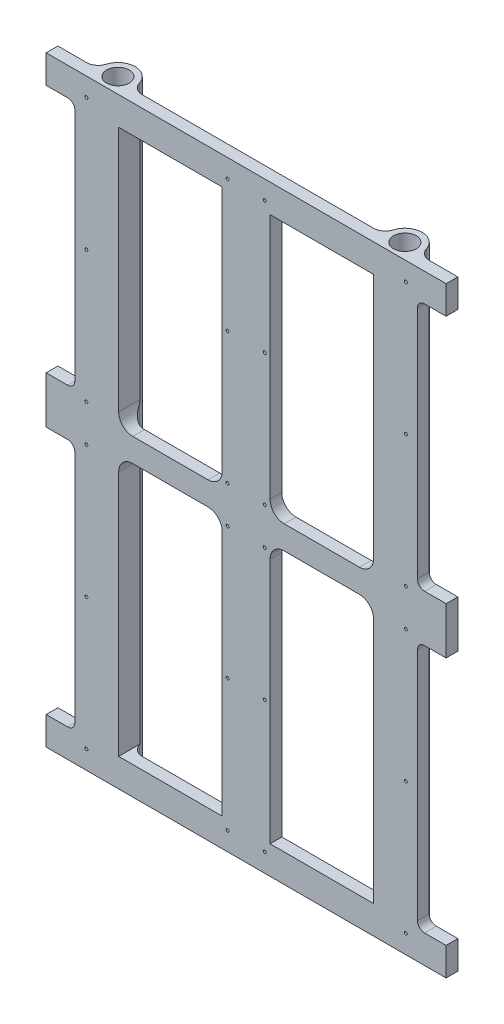
from build123d import *

# Parameters (mm, degrees)
SKETCH1_R                    = 4.825
BOSS_EXTRUDE1_DEPTH          = 255.6
CUT_EXTRUDE2_DEPTH           = 270.507403655
CUT_EXTRUDE2_DEPTH_BACK      = 270.507403655
F_1_25_1_25_DIAMETER_HOLE1_D = 1.25
SKETCH5_R                    = 1.5
CUT_EXTRUDE3_DEPTH           = 270.507403753


with BuildPart() as part:
    # Sketch1 → Boss-Extrude1 (new body)
    with BuildSketch(Plane(origin=(0, 0, 0), x_dir=(1, 0, 0), z_dir=(0, 1, 0))):
        with BuildLine():
            Line((85, -5), (85, 0))
            Line((85, 0), (72.817598106, 0))
            ThreePointArc((72.817598106, 0), (69.825892195, 0.993792849), (68.023440659, 3.580121704))
            ThreePointArc((68.023440659, 3.580121704), (61, 8.825), (53.976559341, 3.580121704))
            ThreePointArc((53.976559341, 3.580121704), (52.174107805, 0.993792849), (49.182401894, 0))
            Line((49.182401894, 0), (-49.182401894, 0))
            ThreePointArc((-49.182401894, 0), (-52.174107805, 0.993792849), (-53.976559341, 3.580121704))
            ThreePointArc((-53.976559341, 3.580121704), (-61, 8.825), (-68.023440659, 3.580121704))
            ThreePointArc((-68.023440659, 3.580121704), (-69.825892195, 0.993792849), (-72.817598106, 0))
            Line((-72.817598106, 0), (-85, 0))
            Line((-85, 0), (-85, -5))
            Line((-85, -5), (85, -5))
        make_face()
        with Locations(Location((-61, 1.5, 0), (0, 0, 270))):
            Circle(SKETCH1_R, mode=Mode.SUBTRACT)
        with Locations(Location((61, 1.5, 0), (0, 0, 90))):
            Circle(SKETCH1_R, mode=Mode.SUBTRACT)
    extrude(amount=BOSS_EXTRUDE1_DEPTH)

    # Sketch2 → Cut-Extrude2 (cut, two sides: drawn at the far end of the back side and taken through both)
    with BuildSketch(Plane(origin=(0, 0, 0), x_dir=(-1, 0, 0), z_dir=(0, 0, -1)).offset(-CUT_EXTRUDE2_DEPTH_BACK)):
        with BuildLine():
            Line((-54.175, 243.6), (-10.175, 243.6))
            Line((-10.175, 243.6), (-10.175, 138.8))
            ThreePointArc((-10.175, 138.8), (-11.932359313, 134.557359313), (-16.175, 132.8))
            Line((-16.175, 132.8), (-48.175, 132.8))
            ThreePointArc((-48.175, 132.8), (-52.417640687, 134.557359313), (-54.175, 138.8))
            Line((-54.175, 138.8), (-54.175, 243.6))
        make_face()
        with BuildLine():
            Line((-87.825, 137.8), (-75.825, 137.8))
            ThreePointArc((-75.825, 137.8), (-73.703679656, 138.678679656), (-72.825, 140.8))
            Line((-72.825, 140.8), (-72.825, 240.6))
            ThreePointArc((-72.825, 240.6), (-73.703679656, 242.721320344), (-75.825, 243.6))
            Line((-75.825, 243.6), (-87.825, 243.6))
            Line((-87.825, 243.6), (-87.825, 137.8))
        make_face()
        with BuildLine():
            Line((-72.825, 114.8), (-72.825, 15))
            ThreePointArc((-72.825, 15), (-73.703679656, 12.878679656), (-75.825, 12))
            Line((-75.825, 12), (-87.825, 12))
            Line((-87.825, 12), (-87.825, 117.8))
            Line((-87.825, 117.8), (-75.825, 117.8))
            ThreePointArc((-75.825, 117.8), (-73.703679656, 116.921320344), (-72.825, 114.8))
        make_face()
        with BuildLine():
            Line((-10.175, 12), (-10.175, 116.8))
            ThreePointArc((-10.175, 116.8), (-11.932359313, 121.042640687), (-16.175, 122.8))
            Line((-16.175, 122.8), (-48.175, 122.8))
            ThreePointArc((-48.175, 122.8), (-52.417640687, 121.042640687), (-54.175, 116.8))
            Line((-54.175, 116.8), (-54.175, 12))
            Line((-54.175, 12), (-10.175, 12))
        make_face()
        with BuildLine():
            Line((54.175, 12), (10.175, 12))
            Line((10.175, 12), (10.175, 116.8))
            ThreePointArc((10.175, 116.8), (11.932359313, 121.042640687), (16.175, 122.8))
            Line((16.175, 122.8), (48.175, 122.8))
            ThreePointArc((48.175, 122.8), (52.417640687, 121.042640687), (54.175, 116.8))
            Line((54.175, 116.8), (54.175, 12))
        make_face()
        with BuildLine():
            Line((87.825, 117.8), (75.825, 117.8))
            ThreePointArc((75.825, 117.8), (73.703679656, 116.921320344), (72.825, 114.8))
            Line((72.825, 114.8), (72.825, 15))
            ThreePointArc((72.825, 15), (73.703679656, 12.878679656), (75.825, 12))
            Line((75.825, 12), (87.825, 12))
            Line((87.825, 12), (87.825, 117.8))
        make_face()
        with BuildLine():
            Line((72.825, 140.8), (72.825, 240.6))
            ThreePointArc((72.825, 240.6), (73.703679656, 242.721320344), (75.825, 243.6))
            Line((75.825, 243.6), (87.825, 243.6))
            Line((87.825, 243.6), (87.825, 137.8))
            Line((87.825, 137.8), (75.825, 137.8))
            ThreePointArc((75.825, 137.8), (73.703679656, 138.678679656), (72.825, 140.8))
        make_face()
        with BuildLine():
            Line((10.175, 243.6), (10.175, 138.8))
            ThreePointArc((10.175, 138.8), (11.932359313, 134.557359313), (16.175, 132.8))
            Line((16.175, 132.8), (48.175, 132.8))
            ThreePointArc((48.175, 132.8), (52.417640687, 134.557359313), (54.175, 138.8))
            Line((54.175, 138.8), (54.175, 243.6))
            Line((54.175, 243.6), (10.175, 243.6))
        make_face()
    extrude(amount=CUT_EXTRUDE2_DEPTH + CUT_EXTRUDE2_DEPTH_BACK, mode=Mode.SUBTRACT)

    # Ø1.25 (1.25) Diameter Hole1 (through all)
    with Locations(Plane(origin=(0, 0, 5), x_dir=(-1, 0, 0), z_dir=(0, 0, 1))):
        with Locations((-67.9, -7.9), (-7.9, -7.9), (-7.9, -63.9), (-67.9, -63.9), (-67.9, -119.9), (-7.9, -119.9), (7.9, -119.9), (67.9, -119.9), (67.9, -63.9), (7.9, -63.9), (7.9, -7.9), (67.9, -7.9), (67.9, -503.3), (7.9, -503.3), (7.9, -447.3), (67.9, -447.3), (67.9, -391.3), (7.9, -391.3), (-7.9, -391.3), (-67.9, -391.3), (-67.9, -447.3), (-7.9, -447.3), (-7.9, -503.3), (-67.9, -503.3), (67.9, -247.7), (7.9, -247.7), (7.9, -191.7), (67.9, -191.7), (67.9, -135.7), (7.9, -135.7), (-7.9, -135.7), (-67.9, -135.7), (-67.9, -191.7), (-7.9, -191.7), (-7.9, -247.7), (-67.9, -247.7)):
            Hole(F_1_25_1_25_DIAMETER_HOLE1_D / 2)

    # Sketch5 → Cut-Extrude3 (cut, through all)
    with BuildSketch(Plane(origin=(0, 0, 0), x_dir=(-1, 0, 0), z_dir=(0, 0, -1))):
        with Locations(Location((-67.9, 247.7, 0), (0, 0, 265.279560629))):
            Circle(SKETCH5_R)
        with Locations((-7.9, 247.7)):
            Circle(SKETCH5_R)
        with Locations(Location((-67.9, 191.7, 0), (0, 0, 265.279560629))):
            Circle(SKETCH5_R)
        with Locations(Location((-67.9, 135.7, 0), (0, 0, 265.279560629))):
            Circle(SKETCH5_R)
        with Locations((-7.9, 135.7)):
            Circle(SKETCH5_R)
        with Locations((-7.9, 191.7)):
            Circle(SKETCH5_R)
        with Locations((7.9, 191.7)):
            Circle(SKETCH5_R)
        with Locations((7.9, 135.7)):
            Circle(SKETCH5_R)
        with Locations(Location((67.9, 135.7, 0), (0, 0, 180))):
            Circle(SKETCH5_R)
        with Locations(Location((67.9, 191.7, 0), (0, 0, 180))):
            Circle(SKETCH5_R)
        with Locations((7.9, 247.7)):
            Circle(SKETCH5_R)
        with Locations(Location((67.9, 247.7, 0), (0, 0, 180))):
            Circle(SKETCH5_R)
        with Locations(Location((67.9, 7.9, 0), (0, 0, 85.279560629))):
            Circle(SKETCH5_R)
        with Locations((7.9, 7.9)):
            Circle(SKETCH5_R)
        with Locations(Location((67.9, 63.9, 0), (0, 0, 85.279560629))):
            Circle(SKETCH5_R)
        with Locations(Location((67.9, 119.9, 0), (0, 0, 85.279560629))):
            Circle(SKETCH5_R)
        with Locations((7.9, 119.9)):
            Circle(SKETCH5_R)
        with Locations((7.9, 63.9)):
            Circle(SKETCH5_R)
        with Locations((-7.9, 63.9)):
            Circle(SKETCH5_R)
        with Locations((-7.9, 119.9)):
            Circle(SKETCH5_R)
        with Locations(Location((-67.9, 119.9, 0), (0, 0, 180))):
            Circle(SKETCH5_R)
        with Locations(Location((-67.9, 63.9, 0), (0, 0, 180))):
            Circle(SKETCH5_R)
        with Locations((-7.9, 7.9)):
            Circle(SKETCH5_R)
        with Locations(Location((-67.9, 7.9, 0), (0, 0, 180))):
            Circle(SKETCH5_R)
    extrude(amount=CUT_EXTRUDE3_DEPTH, mode=Mode.SUBTRACT)


solid = part.part
